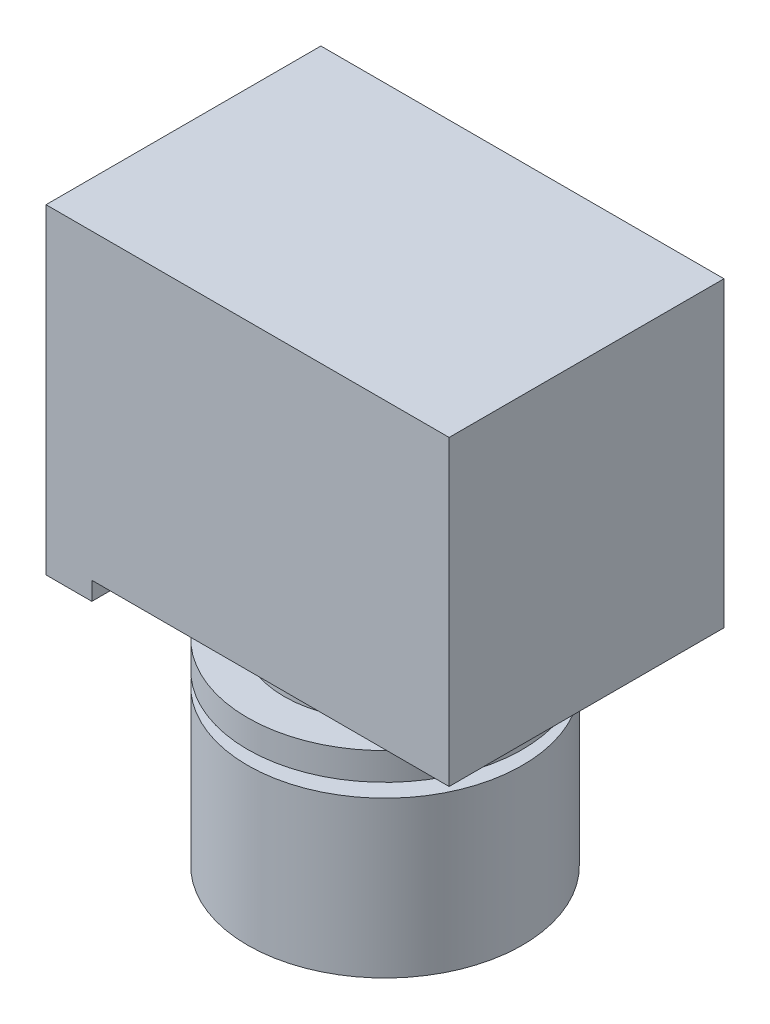
from build123d import *

# Parameters (mm, degrees)
SKETCH_1_R          = 15
EXTRUDE_1_DEPTH     = 17
SKETCH_2_R          = 11
EXTRUDE_2_DEPTH     = 1.5
SKETCH_3_R          = 15
EXTRUDE_3_DEPTH     = 3
SKETCH_4_R          = 11
EXTRUDE_4_DEPTH     = 4.5
SKETCH_6_W          = 44
SKETCH_6_H          = 30
EXTRUDE_6_DEPTH     = 33
SKETCH_7_W          = 5
SKETCH_7_H          = 30
EXTRUDE_7_DEPTH     = 2
SKETCH_9_R          = 13
SKETCH_9_R_2        = 12
CUT_EXTRUDE_2_DEPTH = 2


with BuildPart() as part:
    # 草圖1 → 伸長1 (new body)
    with BuildSketch(Plane(origin=(0, 0, 0), x_dir=(1, 0, 0), z_dir=(0, 1, 0))):
        with Locations(Location((0, 0, 0), (0, 0, 270))):
            Circle(SKETCH_1_R)
    extrude(amount=EXTRUDE_1_DEPTH)

    # 草圖2 → 伸長2 (add)
    with BuildSketch(Plane(origin=(0, 17, 0), x_dir=(1, 0, 0), z_dir=(0, 1, 0))):
        with Locations(Location((0, 0, 0), (0, 0, 270))):
            Circle(SKETCH_2_R)
    extrude(amount=EXTRUDE_2_DEPTH)

    # 草圖3 → 伸長3 (add)
    with BuildSketch(Plane(origin=(0, 18.5, 0), x_dir=(1, 0, 0), z_dir=(0, 1, 0))):
        with Locations(Location((0, 0, 0), (0, 0, 270))):
            Circle(SKETCH_3_R)
    extrude(amount=EXTRUDE_3_DEPTH)

    # 草圖4 → 伸長4 (add)
    with BuildSketch(Plane(origin=(0, 21.5, 0), x_dir=(1, 0, 0), z_dir=(0, 1, 0))):
        with Locations(Location((0, 0, 0), (0, 0, 270))):
            Circle(SKETCH_4_R)
    extrude(amount=EXTRUDE_4_DEPTH)

    # 草圖6 → 伸長6 (add)
    with BuildSketch(Plane(origin=(0, 26, 0), x_dir=(1, 0, 0), z_dir=(0, 1, 0))):
        Rectangle(SKETCH_6_W, SKETCH_6_H)
    extrude(amount=EXTRUDE_6_DEPTH)

    # 草圖7 → 伸長7 (add)
    with BuildSketch(Plane.XZ.offset(-26)):
        with Locations((-19.5, 0)):
            Rectangle(SKETCH_7_W, SKETCH_7_H)
    extrude(amount=EXTRUDE_7_DEPTH)

    # 草圖9 → 除料-伸長2 (cut)
    with BuildSketch(Plane.XZ):
        with Locations(Location((0, 0, 0), (0, 0, 270))):
            Circle(SKETCH_9_R)
        with Locations(Location((0, 0, 0), (0, 0, 270))):
            Circle(SKETCH_9_R_2, mode=Mode.SUBTRACT)
    extrude(amount=-CUT_EXTRUDE_2_DEPTH, mode=Mode.SUBTRACT)


solid = part.part
